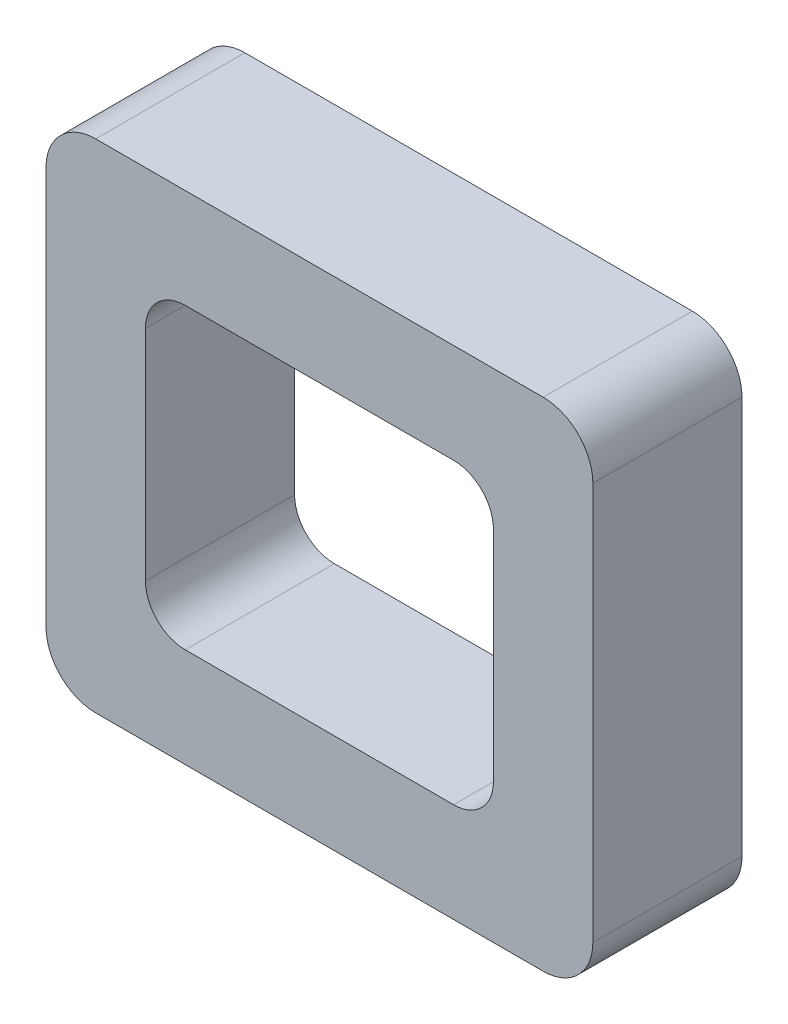
from build123d import *

# Parameters (mm, degrees)
EXTRUDE_1_DEPTH     = 3
CUT_EXTRUDE_1_DEPTH = 3


with BuildPart() as part:
    # 草图1 → 凸台-拉伸1 (new body)
    with BuildSketch(Plane.XY):
        with BuildLine():
            Line((-6.425519106, 6.87161757), (2.574480894, 6.87161757))
            ThreePointArc((2.574480894, 6.87161757), (3.281587675, 6.578724351), (3.574480894, 5.87161757))
            Line((3.574480894, 5.87161757), (3.574480894, -2.12838243))
            ThreePointArc((3.574480894, -2.12838243), (3.281587675, -2.835489211), (2.574480894, -3.12838243))
            Line((2.574480894, -3.12838243), (-6.425519106, -3.12838243))
            ThreePointArc((-6.425519106, -3.12838243), (-7.132625887, -2.835489211), (-7.425519106, -2.12838243))
            Line((-7.425519106, -2.12838243), (-7.425519106, 5.87161757))
            ThreePointArc((-7.425519106, 5.87161757), (-7.132625887, 6.578724351), (-6.425519106, 6.87161757))
        make_face()
    extrude(amount=EXTRUDE_1_DEPTH)

    # 草图3 → 切除-拉伸1 (cut)
    with BuildSketch(Plane(origin=(0, 0, 0), x_dir=(-1, 0, 0), z_dir=(0, 0, -1))):
        with BuildLine():
            Line((5.425519106, -0.32838243), (5.425519106, 4.07161757))
            ThreePointArc((5.425519106, 4.07161757), (5.191204531, 4.637302995), (4.625519106, 4.87161757))
            Line((4.625519106, 4.87161757), (-0.774480894, 4.87161757))
            ThreePointArc((-0.774480894, 4.87161757), (-1.340166319, 4.637302995), (-1.574480894, 4.07161757))
            Line((-1.574480894, 4.07161757), (-1.574480894, -0.32838243))
            ThreePointArc((-1.574480894, -0.32838243), (-1.340166319, -0.894067855), (-0.774480894, -1.12838243))
            Line((-0.774480894, -1.12838243), (4.625519106, -1.12838243))
            ThreePointArc((4.625519106, -1.12838243), (5.191204531, -0.894067855), (5.425519106, -0.32838243))
        make_face()
    extrude(amount=-CUT_EXTRUDE_1_DEPTH, mode=Mode.SUBTRACT)


solid = part.part
